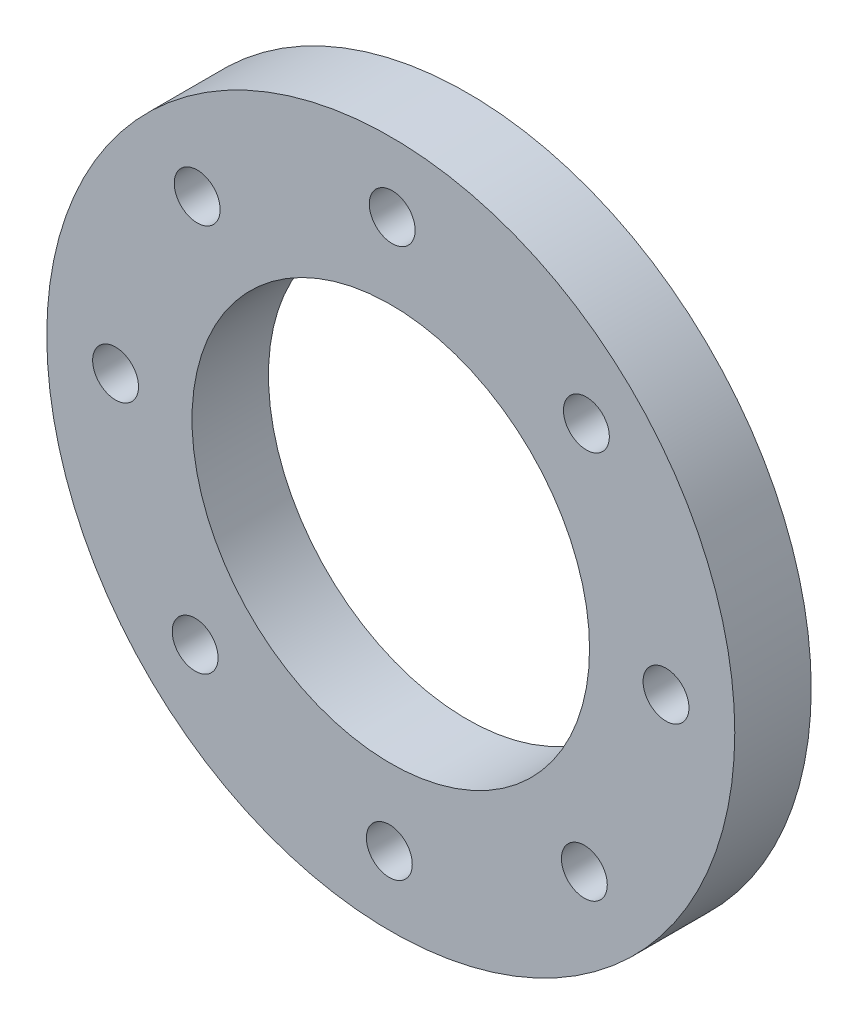
from build123d import *

# Parameters (mm, degrees)
ESQUISSE1_R        = 22.5
ESQUISSE1_R_2      = 13
ESQUISSE1_R_3      = 1.5
BOSS_EXTRU_1_DEPTH = 5


with BuildPart() as part:
    # Esquisse1 → Boss.-Extru.1 (new body)
    with BuildSketch(Plane.XY):
        Circle(ESQUISSE1_R)
        Circle(ESQUISSE1_R_2, mode=Mode.SUBTRACT)
        with Locations((-12.660875573, 12.794617217)):
            Circle(ESQUISSE1_R_3, mode=Mode.SUBTRACT)
        with Locations((0.094569623, 17.99975157)):
            Circle(ESQUISSE1_R_3, mode=Mode.SUBTRACT)
        with Locations((12.794617217, 12.660875573)):
            Circle(ESQUISSE1_R_3, mode=Mode.SUBTRACT)
        with Locations((17.99975157, -0.094569623)):
            Circle(ESQUISSE1_R_3, mode=Mode.SUBTRACT)
        with Locations((12.660875573, -12.794617217)):
            Circle(ESQUISSE1_R_3, mode=Mode.SUBTRACT)
        with Locations((-0.094569623, -17.99975157)):
            Circle(ESQUISSE1_R_3, mode=Mode.SUBTRACT)
        with Locations((-12.794617217, -12.660875573)):
            Circle(ESQUISSE1_R_3, mode=Mode.SUBTRACT)
        with Locations((-17.99975157, 0.094569623)):
            Circle(ESQUISSE1_R_3, mode=Mode.SUBTRACT)
    extrude(amount=BOSS_EXTRU_1_DEPTH)


solid = part.part
